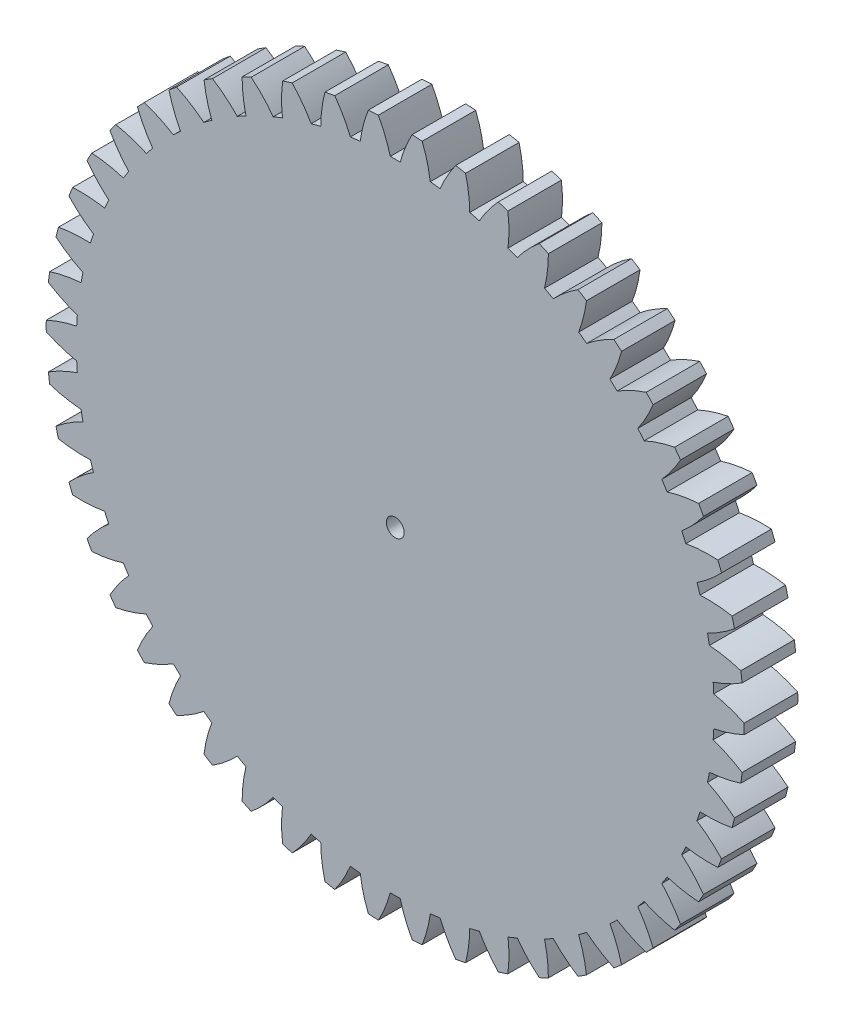
from build123d import *

# Parameters (mm, degrees)
SKETCH1_R           = 1
BOSS_EXTRUDE1_DEPTH = 6


with BuildPart() as part:
    # Sketch1 → Boss-Extrude1 (new body)
    with BuildSketch(Plane.XY):
        with BuildLine():
            ThreePointArc((6.777448796, 38.533515449), (5.81009531, 37.015529267), (5.029926553, 35.393372824))
            ThreePointArc((5.029926553, 35.393372824), (4.480537767, 35.467108457), (3.930071733, 35.5323168))
            ThreePointArc((3.930071733, 35.5323168), (3.577827315, 37.297530295), (3.01837283, 39.008397179))
            ThreePointArc((3.01837283, 39.008397179), (2.456679077, 39.04779575), (1.894476496, 39.079106743))
            ThreePointArc((1.894476496, 39.079106743), (1.125004998, 37.451848795), (0.554298217, 35.744702467))
            ThreePointArc((0.554298217, 35.744702467), (0, 35.749), (-0.554298217, 35.744702467))
            ThreePointArc((-0.554298217, 35.744702467), (-1.125004998, 37.451848795), (-1.894476496, 39.079106743))
            ThreePointArc((-1.894476496, 39.079106743), (-2.456679077, 39.04779575), (-3.01837283, 39.008397179))
            ThreePointArc((-3.01837283, 39.008397179), (-3.577827315, 37.297530295), (-3.930071733, 35.5323168))
            ThreePointArc((-3.930071733, 35.5323168), (-4.480537767, 35.467108457), (-5.029926553, 35.393372824))
            ThreePointArc((-5.029926553, 35.393372824), (-5.81009531, 37.015529267), (-6.777448796, 38.533515449))
            ThreePointArc((-6.777448796, 38.533515449), (-7.331293933, 38.431988685), (-7.883620613, 38.322501889))
            ThreePointArc((-7.883620613, 38.322501889), (-8.224235154, 36.555007462), (-8.352462105, 34.75956527))
            ThreePointArc((-8.352462105, 34.75956527), (-8.890414776, 34.625879427), (-9.426229942, 34.483868549))
            ThreePointArc((-9.426229942, 34.483868549), (-10.403556948, 35.99545273), (-11.55353668, 37.380227597))
            ThreePointArc((-11.55353668, 37.380227597), (-12.090289905, 37.2100862), (-12.62453899, 37.032237852))
            ThreePointArc((-12.62453899, 37.032237852), (-12.740941891, 35.235990324), (-12.643129159, 33.438634632))
            ThreePointArc((-12.643129159, 33.438634632), (-13.160084634, 33.238579594), (-13.673876055, 33.030533066))
            ThreePointArc((-13.673876055, 33.030533066), (-14.832948279, 34.407706401), (-16.147418388, 35.637431226))
            ThreePointArc((-16.147418388, 35.637431226), (-16.658614782, 35.401358428), (-17.166360845, 35.157953301))
            ThreePointArc((-17.166360845, 35.157953301), (-17.056716364, 33.36128057), (-16.734406513, 31.590356751))
            ThreePointArc((-16.734406513, 31.590356751), (-17.222212095, 31.327087505), (-17.705876973, 31.056286346))
            ThreePointArc((-17.705876973, 31.056286346), (-19.028415154, 32.277329988), (-20.486645663, 33.332611276))
            ThreePointArc((-20.486645663, 33.332611276), (-20.964223354, 33.034330085), (-21.437458935, 32.729206825))
            ThreePointArc((-21.437458935, 32.729206825), (-21.103496231, 30.960443493), (-20.561772281, 29.243880072))
            ThreePointArc((-20.561772281, 29.243880072), (-21.012734984, 28.921548532), (-21.458645635, 28.592263438))
            ThreePointArc((-21.458645635, 28.592263438), (-22.923792555, 29.637920799), (-24.502786297, 30.502116135))
            ThreePointArc((-24.502786297, 30.502116135), (-24.939213599, 30.146330624), (-25.370475492, 29.784301206))
            ThreePointArc((-25.370475492, 29.784301206), (-24.817461355, 28.071341726), (-24.064866616, 26.436209935))
            ThreePointArc((-24.064866616, 26.436209935), (-24.47187449, 26.059899462), (-24.872998637, 25.677323455))
            ThreePointArc((-24.872998637, 25.677323455), (-26.457648054, 26.531103895), (-28.132503354, 27.1905844))
            ThreePointArc((-28.132503354, 27.1905844), (-28.520897548, 26.782905519), (-28.903384495, 26.369679364))
            ThreePointArc((-28.903384495, 26.369679364), (-28.140040289, 24.739538132), (-27.18844363, 23.211624976))
            ThreePointArc((-27.18844363, 23.211624976), (-27.545077916, 22.78727021), (-27.895089591, 22.357436743))
            ThreePointArc((-27.895089591, 22.357436743), (-29.574250637, 23.005875633), (-31.318554028, 23.450240907))
            ThreePointArc((-31.318554028, 23.450240907), (-31.652789905, 22.997097996), (-31.980469858, 22.539191926))
            ThreePointArc((-31.980469858, 22.539191926), (-31.018833977, 21.017577242), (-29.883242645, 19.620978824))
            ThreePointArc((-29.883242645, 19.620978824), (-30.183879009, 19.155272094), (-30.477258319, 18.684959897))
            ThreePointArc((-30.477258319, 18.684959897), (-32.224449622, 19.11783097), (-34.010692396, 19.340073107))
            ThreePointArc((-34.010692396, 19.340073107), (-34.285498857, 18.848612499), (-34.553204107, 18.353247968))
            ThreePointArc((-34.553204107, 18.353247968), (-33.408442124, 16.964156604), (-32.106765073, 15.720898115))
            ThreePointArc((-32.106765073, 15.720898115), (-32.346662299, 15.221183894), (-32.578782477, 14.717810072))
            ThreePointArc((-32.578782477, 14.717810072), (-34.366449786, 14.928286691), (-36.166461827, 14.9249008))
            ThreePointArc((-36.166461827, 14.9249008), (-36.37750501, 14.402873124), (-36.581013686, 13.877862325))
            ThreePointArc((-36.581013686, 13.877862325), (-35.271179181, 12.643201083), (-33.823944636, 11.572889452))
            ThreePointArc((-33.823944636, 11.572889452), (-33.999319401, 11.047048532), (-34.166519774, 10.51855159))
            ThreePointArc((-34.166519774, 10.51855159), (-35.966470507, 10.503314414), (-37.751864551, 10.274353892))
            ThreePointArc((-37.751864551, 10.274353892), (-37.895816179, 9.729991835), (-38.031918827, 9.183614503))
            ThreePointArc((-38.031918827, 9.183614503), (-36.577668672, 8.122854727), (-35.007700386, 7.242369409))
            ThreePointArc((-35.007700386, 7.242369409), (-35.115786926, 6.698694615), (-35.215430643, 6.153409267))
            ThreePointArc((-35.215430643, 6.153409267), (-36.999278503, 5.912698594), (-38.741897819, 5.461774285))
            ThreePointArc((-38.741897819, 5.461774285), (-38.816487689, 4.903662763), (-38.883037889, 4.344535594))
            ThreePointArc((-38.883037889, 4.344535594), (-37.307306478, 3.474406101), (-35.639363789, 2.797632874))
            ThreePointArc((-35.639363789, 2.797632874), (-35.678457515, 2.244698283), (-35.708973135, 1.691224003))
            ThreePointArc((-35.708973135, 1.691224003), (-37.448585775, 1.228835986), (-39.120948216, 0.563059236))
            ThreePointArc((-39.120948216, 0.563059236), (-39.125, 0), (-39.120948216, -0.563059236))
            ThreePointArc((-39.120948216, -0.563059236), (-37.448585775, -1.228835986), (-35.708973135, -1.691224003))
            ThreePointArc((-35.708973135, -1.691224003), (-35.678457515, -2.244698283), (-35.639363789, -2.797632874))
            ThreePointArc((-35.639363789, -2.797632874), (-37.307306478, -3.474406101), (-38.883037889, -4.344535594))
            ThreePointArc((-38.883037889, -4.344535594), (-38.816487689, -4.903662763), (-38.741897819, -5.461774285))
            ThreePointArc((-38.741897819, -5.461774285), (-36.999278503, -5.912698594), (-35.215430643, -6.153409267))
            ThreePointArc((-35.215430643, -6.153409267), (-35.115786926, -6.698694615), (-35.007700386, -7.242369409))
            ThreePointArc((-35.007700386, -7.242369409), (-36.577668672, -8.122854727), (-38.031918827, -9.183614503))
            ThreePointArc((-38.031918827, -9.183614503), (-37.895816179, -9.729991835), (-37.751864551, -10.274353892))
            ThreePointArc((-37.751864551, -10.274353892), (-35.966470507, -10.503314414), (-34.166519774, -10.51855159))
            ThreePointArc((-34.166519774, -10.51855159), (-33.999319401, -11.047048532), (-33.823944636, -11.572889452))
            ThreePointArc((-33.823944636, -11.572889452), (-35.271179181, -12.643201083), (-36.581013686, -13.877862325))
            ThreePointArc((-36.581013686, -13.877862325), (-36.37750501, -14.402873124), (-36.166461827, -14.9249008))
            ThreePointArc((-36.166461827, -14.9249008), (-34.366449786, -14.928286691), (-32.578782477, -14.717810072))
            ThreePointArc((-32.578782477, -14.717810072), (-32.346662299, -15.221183894), (-32.106765073, -15.720898115))
            ThreePointArc((-32.106765073, -15.720898115), (-33.408442124, -16.964156604), (-34.553204107, -18.353247968))
            ThreePointArc((-34.553204107, -18.353247968), (-34.285498857, -18.848612499), (-34.010692396, -19.340073107))
            ThreePointArc((-34.010692396, -19.340073107), (-32.224449622, -19.11783097), (-30.477258319, -18.684959897))
            ThreePointArc((-30.477258319, -18.684959897), (-30.183879009, -19.155272094), (-29.883242645, -19.620978824))
            ThreePointArc((-29.883242645, -19.620978824), (-31.018833977, -21.017577242), (-31.980469858, -22.539191926))
            ThreePointArc((-31.980469858, -22.539191926), (-31.652789905, -22.997097996), (-31.318554028, -23.450240907))
            ThreePointArc((-31.318554028, -23.450240907), (-29.574250637, -23.005875633), (-27.895089591, -22.357436743))
            ThreePointArc((-27.895089591, -22.357436743), (-27.545077916, -22.78727021), (-27.18844363, -23.211624976))
            ThreePointArc((-27.18844363, -23.211624976), (-28.140040289, -24.739538132), (-28.903384495, -26.369679364))
            ThreePointArc((-28.903384495, -26.369679364), (-28.520897548, -26.782905519), (-28.132503354, -27.1905844))
            ThreePointArc((-28.132503354, -27.1905844), (-26.457648054, -26.531103895), (-24.872998637, -25.677323455))
            ThreePointArc((-24.872998637, -25.677323455), (-24.47187449, -26.059899462), (-24.064866616, -26.436209935))
            ThreePointArc((-24.064866616, -26.436209935), (-24.817461355, -28.071341726), (-25.370475492, -29.784301206))
            ThreePointArc((-25.370475492, -29.784301206), (-24.939213599, -30.146330624), (-24.502786297, -30.502116135))
            ThreePointArc((-24.502786297, -30.502116135), (-22.923792555, -29.637920799), (-21.458645635, -28.592263438))
            ThreePointArc((-21.458645635, -28.592263438), (-21.012734984, -28.921548532), (-20.561772281, -29.243880072))
            ThreePointArc((-20.561772281, -29.243880072), (-21.103496231, -30.960443493), (-21.437458935, -32.729206825))
            ThreePointArc((-21.437458935, -32.729206825), (-20.964223354, -33.034330085), (-20.486645663, -33.332611276))
            ThreePointArc((-20.486645663, -33.332611276), (-19.028415154, -32.277329988), (-17.705876973, -31.056286346))
            ThreePointArc((-17.705876973, -31.056286346), (-17.222212095, -31.327087505), (-16.734406513, -31.590356751))
            ThreePointArc((-16.734406513, -31.590356751), (-17.056716364, -33.36128057), (-17.166360845, -35.157953301))
            ThreePointArc((-17.166360845, -35.157953301), (-16.658614782, -35.401358428), (-16.147418388, -35.637431226))
            ThreePointArc((-16.147418388, -35.637431226), (-14.832948279, -34.407706401), (-13.673876055, -33.030533066))
            ThreePointArc((-13.673876055, -33.030533066), (-13.160084634, -33.238579594), (-12.643129159, -33.438634632))
            ThreePointArc((-12.643129159, -33.438634632), (-12.740941891, -35.235990324), (-12.62453899, -37.032237852))
            ThreePointArc((-12.62453899, -37.032237852), (-12.090289905, -37.2100862), (-11.55353668, -37.380227597))
            ThreePointArc((-11.55353668, -37.380227597), (-10.403556948, -35.99545273), (-9.426229942, -34.483868549))
            ThreePointArc((-9.426229942, -34.483868549), (-8.890414776, -34.625879427), (-8.352462105, -34.75956527))
            ThreePointArc((-8.352462105, -34.75956527), (-8.224235154, -36.555007462), (-7.883620613, -38.322501889))
            ThreePointArc((-7.883620613, -38.322501889), (-7.331293933, -38.431988685), (-6.777448796, -38.533515449))
            ThreePointArc((-6.777448796, -38.533515449), (-5.81009531, -37.015529267), (-5.029926553, -35.393372824))
            ThreePointArc((-5.029926553, -35.393372824), (-4.480537767, -35.467108457), (-3.930071733, -35.5323168))
            ThreePointArc((-3.930071733, -35.5323168), (-3.577827315, -37.297530295), (-3.01837283, -39.008397179))
            ThreePointArc((-3.01837283, -39.008397179), (-2.456679077, -39.04779575), (-1.894476496, -39.079106743))
            ThreePointArc((-1.894476496, -39.079106743), (-1.125004998, -37.451848795), (-0.554298217, -35.744702467))
            ThreePointArc((-0.554298217, -35.744702467), (0, -35.749), (0.554298217, -35.744702467))
            ThreePointArc((0.554298217, -35.744702467), (1.125004998, -37.451848795), (1.894476496, -39.079106743))
            ThreePointArc((1.894476496, -39.079106743), (2.456679077, -39.04779575), (3.01837283, -39.008397179))
            ThreePointArc((3.01837283, -39.008397179), (3.577827315, -37.297530295), (3.930071733, -35.5323168))
            ThreePointArc((3.930071733, -35.5323168), (4.480537767, -35.467108457), (5.029926553, -35.393372824))
            ThreePointArc((5.029926553, -35.393372824), (5.81009531, -37.015529267), (6.777448796, -38.533515449))
            ThreePointArc((6.777448796, -38.533515449), (7.331293933, -38.431988685), (7.883620613, -38.322501889))
            ThreePointArc((7.883620613, -38.322501889), (8.224235154, -36.555007462), (8.352462105, -34.75956527))
            ThreePointArc((8.352462105, -34.75956527), (8.890414776, -34.625879427), (9.426229942, -34.483868549))
            ThreePointArc((9.426229942, -34.483868549), (10.403556948, -35.99545273), (11.55353668, -37.380227597))
            ThreePointArc((11.55353668, -37.380227597), (12.090289905, -37.2100862), (12.62453899, -37.032237852))
            ThreePointArc((12.62453899, -37.032237852), (12.740941891, -35.235990324), (12.643129159, -33.438634632))
            ThreePointArc((12.643129159, -33.438634632), (13.160084634, -33.238579594), (13.673876055, -33.030533066))
            ThreePointArc((13.673876055, -33.030533066), (14.832948279, -34.407706401), (16.147418388, -35.637431226))
            ThreePointArc((16.147418388, -35.637431226), (16.658614782, -35.401358428), (17.166360845, -35.157953301))
            ThreePointArc((17.166360845, -35.157953301), (17.056716364, -33.36128057), (16.734406513, -31.590356751))
            ThreePointArc((16.734406513, -31.590356751), (17.222212095, -31.327087505), (17.705876973, -31.056286346))
            ThreePointArc((17.705876973, -31.056286346), (19.028415154, -32.277329988), (20.486645663, -33.332611276))
            ThreePointArc((20.486645663, -33.332611276), (20.964223354, -33.034330085), (21.437458935, -32.729206825))
            ThreePointArc((21.437458935, -32.729206825), (21.103496231, -30.960443493), (20.561772281, -29.243880072))
            ThreePointArc((20.561772281, -29.243880072), (21.012734984, -28.921548532), (21.458645635, -28.592263438))
            ThreePointArc((21.458645635, -28.592263438), (22.923792555, -29.637920799), (24.502786297, -30.502116135))
            ThreePointArc((24.502786297, -30.502116135), (24.939213599, -30.146330624), (25.370475492, -29.784301206))
            ThreePointArc((25.370475492, -29.784301206), (24.817461355, -28.071341726), (24.064866616, -26.436209935))
            ThreePointArc((24.064866616, -26.436209935), (24.47187449, -26.059899462), (24.872998637, -25.677323455))
            ThreePointArc((24.872998637, -25.677323455), (26.457648054, -26.531103895), (28.132503354, -27.1905844))
            ThreePointArc((28.132503354, -27.1905844), (28.520897548, -26.782905519), (28.903384495, -26.369679364))
            ThreePointArc((28.903384495, -26.369679364), (28.140040289, -24.739538132), (27.18844363, -23.211624976))
            ThreePointArc((27.18844363, -23.211624976), (27.545077916, -22.78727021), (27.895089591, -22.357436743))
            ThreePointArc((27.895089591, -22.357436743), (29.574250637, -23.005875633), (31.318554028, -23.450240907))
            ThreePointArc((31.318554028, -23.450240907), (31.652789905, -22.997097996), (31.980469858, -22.539191926))
            ThreePointArc((31.980469858, -22.539191926), (31.018833977, -21.017577242), (29.883242645, -19.620978824))
            ThreePointArc((29.883242645, -19.620978824), (30.183879009, -19.155272094), (30.477258319, -18.684959897))
            ThreePointArc((30.477258319, -18.684959897), (32.224449622, -19.11783097), (34.010692396, -19.340073107))
            ThreePointArc((34.010692396, -19.340073107), (34.285498857, -18.848612499), (34.553204107, -18.353247968))
            ThreePointArc((34.553204107, -18.353247968), (33.408442124, -16.964156604), (32.106765073, -15.720898115))
            ThreePointArc((32.106765073, -15.720898115), (32.346662299, -15.221183894), (32.578782477, -14.717810072))
            ThreePointArc((32.578782477, -14.717810072), (34.366449786, -14.928286691), (36.166461827, -14.9249008))
            ThreePointArc((36.166461827, -14.9249008), (36.37750501, -14.402873124), (36.581013686, -13.877862325))
            ThreePointArc((36.581013686, -13.877862325), (35.271179181, -12.643201083), (33.823944636, -11.572889452))
            ThreePointArc((33.823944636, -11.572889452), (33.999319401, -11.047048532), (34.166519774, -10.51855159))
            ThreePointArc((34.166519774, -10.51855159), (35.966470507, -10.503314414), (37.751864551, -10.274353892))
            ThreePointArc((37.751864551, -10.274353892), (37.895816179, -9.729991835), (38.031918827, -9.183614503))
            ThreePointArc((38.031918827, -9.183614503), (36.577668672, -8.122854727), (35.007700386, -7.242369409))
            ThreePointArc((35.007700386, -7.242369409), (35.115786926, -6.698694615), (35.215430643, -6.153409267))
            ThreePointArc((35.215430643, -6.153409267), (36.999278503, -5.912698594), (38.741897819, -5.461774285))
            ThreePointArc((38.741897819, -5.461774285), (38.816487689, -4.903662763), (38.883037889, -4.344535594))
            ThreePointArc((38.883037889, -4.344535594), (37.307306478, -3.474406101), (35.639363789, -2.797632874))
            ThreePointArc((35.639363789, -2.797632874), (35.678457515, -2.244698283), (35.708973135, -1.691224003))
            ThreePointArc((35.708973135, -1.691224003), (37.448585775, -1.228835986), (39.120948216, -0.563059236))
            ThreePointArc((39.120948216, -0.563059236), (39.125, 0), (39.120948216, 0.563059236))
            ThreePointArc((39.120948216, 0.563059236), (37.448585775, 1.228835986), (35.708973135, 1.691224003))
            ThreePointArc((35.708973135, 1.691224003), (35.678457515, 2.244698283), (35.639363789, 2.797632874))
            ThreePointArc((35.639363789, 2.797632874), (37.307306478, 3.474406101), (38.883037889, 4.344535594))
            ThreePointArc((38.883037889, 4.344535594), (38.816487689, 4.903662763), (38.741897819, 5.461774285))
            ThreePointArc((38.741897819, 5.461774285), (36.999278503, 5.912698594), (35.215430643, 6.153409267))
            ThreePointArc((35.215430643, 6.153409267), (35.115786926, 6.698694615), (35.007700386, 7.242369409))
            ThreePointArc((35.007700386, 7.242369409), (36.577668672, 8.122854727), (38.031918827, 9.183614503))
            ThreePointArc((38.031918827, 9.183614503), (37.895816179, 9.729991835), (37.751864551, 10.274353892))
            ThreePointArc((37.751864551, 10.274353892), (35.966470507, 10.503314414), (34.166519774, 10.51855159))
            ThreePointArc((34.166519774, 10.51855159), (33.999319401, 11.047048532), (33.823944636, 11.572889452))
            ThreePointArc((33.823944636, 11.572889452), (35.271179181, 12.643201083), (36.581013686, 13.877862325))
            ThreePointArc((36.581013686, 13.877862325), (36.37750501, 14.402873124), (36.166461827, 14.9249008))
            ThreePointArc((36.166461827, 14.9249008), (34.366449786, 14.928286691), (32.578782477, 14.717810072))
            ThreePointArc((32.578782477, 14.717810072), (32.346662299, 15.221183894), (32.106765073, 15.720898115))
            ThreePointArc((32.106765073, 15.720898115), (33.408442124, 16.964156604), (34.553204107, 18.353247968))
            ThreePointArc((34.553204107, 18.353247968), (34.285498857, 18.848612499), (34.010692396, 19.340073107))
            ThreePointArc((34.010692396, 19.340073107), (32.224449622, 19.11783097), (30.477258319, 18.684959897))
            ThreePointArc((30.477258319, 18.684959897), (30.183879009, 19.155272094), (29.883242645, 19.620978824))
            ThreePointArc((29.883242645, 19.620978824), (31.018833977, 21.017577242), (31.980469858, 22.539191926))
            ThreePointArc((31.980469858, 22.539191926), (31.652789905, 22.997097996), (31.318554028, 23.450240907))
            ThreePointArc((31.318554028, 23.450240907), (29.574250637, 23.005875633), (27.895089591, 22.357436743))
            ThreePointArc((27.895089591, 22.357436743), (27.545077916, 22.78727021), (27.18844363, 23.211624976))
            ThreePointArc((27.18844363, 23.211624976), (28.140040289, 24.739538132), (28.903384495, 26.369679364))
            ThreePointArc((28.903384495, 26.369679364), (28.520897548, 26.782905519), (28.132503354, 27.1905844))
            ThreePointArc((28.132503354, 27.1905844), (26.457648054, 26.531103895), (24.872998637, 25.677323455))
            ThreePointArc((24.872998637, 25.677323455), (24.47187449, 26.059899462), (24.064866616, 26.436209935))
            ThreePointArc((24.064866616, 26.436209935), (24.817461355, 28.071341726), (25.370475492, 29.784301206))
            ThreePointArc((25.370475492, 29.784301206), (24.939213599, 30.146330624), (24.502786297, 30.502116135))
            ThreePointArc((24.502786297, 30.502116135), (22.923792555, 29.637920799), (21.458645635, 28.592263438))
            ThreePointArc((21.458645635, 28.592263438), (21.012734984, 28.921548532), (20.561772281, 29.243880072))
            ThreePointArc((20.561772281, 29.243880072), (21.103496231, 30.960443493), (21.437458935, 32.729206825))
            ThreePointArc((21.437458935, 32.729206825), (20.964223354, 33.034330085), (20.486645663, 33.332611276))
            ThreePointArc((20.486645663, 33.332611276), (19.028415154, 32.277329988), (17.705876973, 31.056286346))
            ThreePointArc((17.705876973, 31.056286346), (17.222212095, 31.327087505), (16.734406513, 31.590356751))
            ThreePointArc((16.734406513, 31.590356751), (17.056716364, 33.36128057), (17.166360845, 35.157953301))
            ThreePointArc((17.166360845, 35.157953301), (16.658614782, 35.401358428), (16.147418388, 35.637431226))
            ThreePointArc((16.147418388, 35.637431226), (14.832948279, 34.407706401), (13.673876055, 33.030533066))
            ThreePointArc((13.673876055, 33.030533066), (13.160084634, 33.238579594), (12.643129159, 33.438634632))
            ThreePointArc((12.643129159, 33.438634632), (12.740941891, 35.235990324), (12.62453899, 37.032237852))
            ThreePointArc((12.62453899, 37.032237852), (12.090289905, 37.2100862), (11.55353668, 37.380227597))
            ThreePointArc((11.55353668, 37.380227597), (10.403556948, 35.99545273), (9.426229942, 34.483868549))
            ThreePointArc((9.426229942, 34.483868549), (8.890414776, 34.625879427), (8.352462105, 34.75956527))
            ThreePointArc((8.352462105, 34.75956527), (8.224235154, 36.555007462), (7.883620613, 38.322501889))
            ThreePointArc((7.883620613, 38.322501889), (7.331293933, 38.431988685), (6.777448796, 38.533515449))
        make_face()
        Circle(SKETCH1_R, mode=Mode.SUBTRACT)
    extrude(amount=BOSS_EXTRUDE1_DEPTH)


solid = part.part
